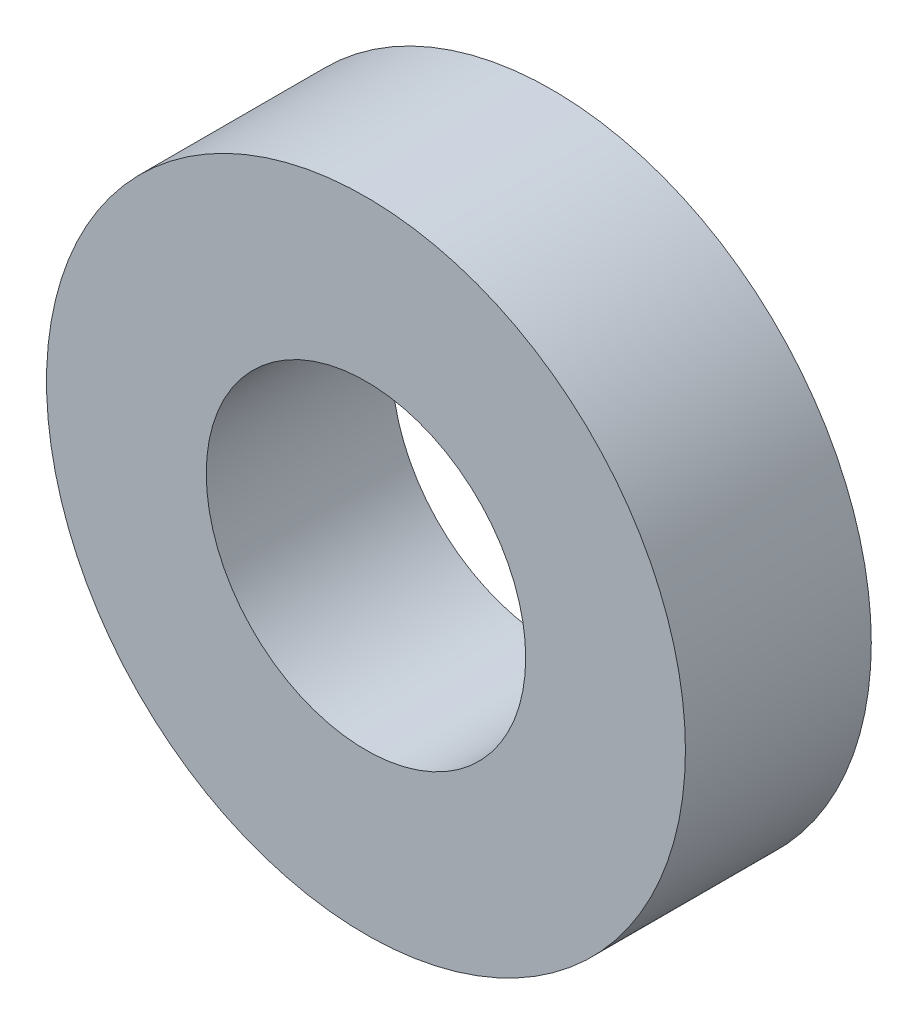
from build123d import *

# Parameters (mm, degrees)
BASES_R    = 5.5
BASES_R_2  = 2.75
BASE_DEPTH = 3.2


with BuildPart() as part:
    # BaseS → BASE (new body)
    with BuildSketch(Plane.XY):
        Circle(BASES_R)
        Circle(BASES_R_2, mode=Mode.SUBTRACT)
    extrude(amount=BASE_DEPTH)


solid = part.part
